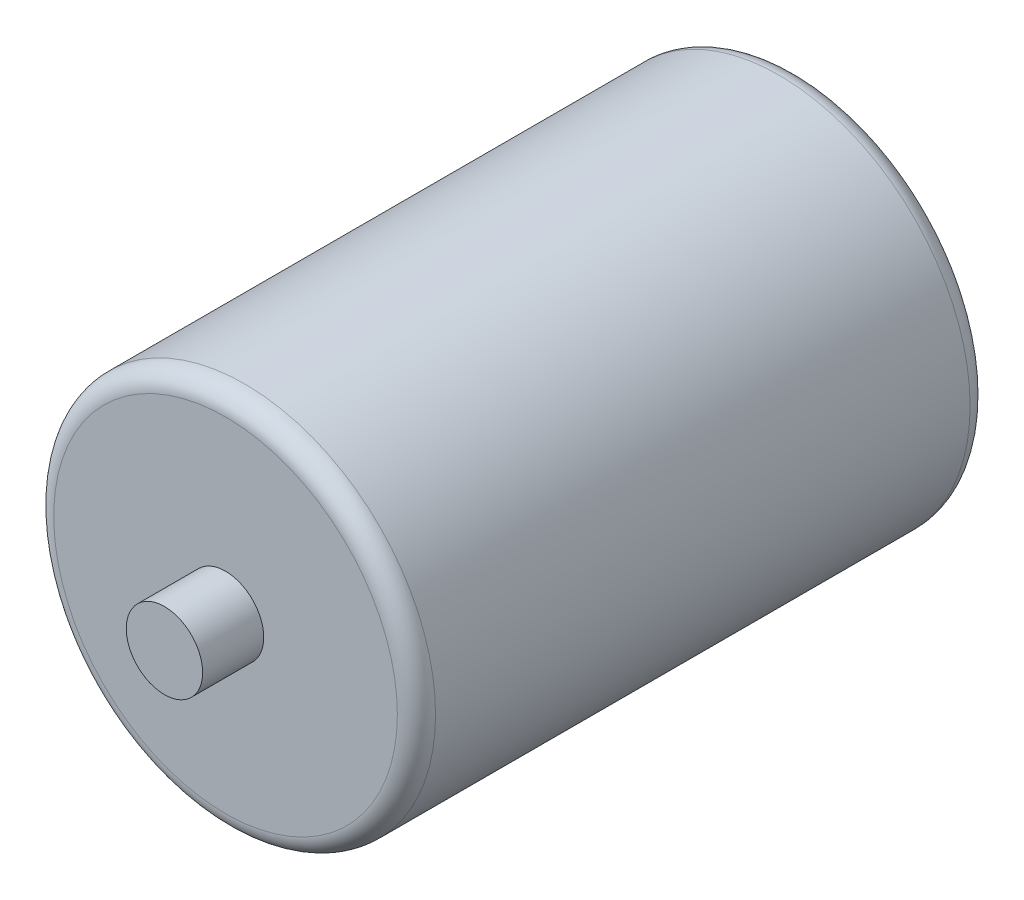
from build123d import *

# Parameters (mm, degrees)
SKETCH2_R           = 1270
BOSS_EXTRUDE1_DEPTH = 3810
SKETCH3_R           = 254
BOSS_EXTRUDE2_DEPTH = 406.4
BOSS_EXTRUDE3_START = 406.4
SKETCH4_R           = 254
BOSS_EXTRUDE3_DEPTH = 406.4
FILLET1_R           = 127


with BuildPart() as part:
    # Sketch2 → Boss-Extrude1 (new body)
    with BuildSketch(Plane.XY):
        Circle(SKETCH2_R)
    extrude(amount=BOSS_EXTRUDE1_DEPTH)

    # Sketch3 → Boss-Extrude2 (add)
    with BuildSketch(Plane.XY.offset(3810)):
        Circle(SKETCH3_R)
    extrude(amount=BOSS_EXTRUDE2_DEPTH)

    # Sketch4 → Boss-Extrude3 (add)
    with BuildSketch(Plane(origin=(0, 0, 0), x_dir=(-1, 0, 0), z_dir=(0, 0, -1)).offset(BOSS_EXTRUDE3_START)):
        with Locations(Location((0, 0, 0), (0, 0, 180))):
            Circle(SKETCH4_R)
    extrude(amount=-BOSS_EXTRUDE3_DEPTH)

    # Fillet1
    fillet1_edges = [part.edges().sort_by_distance(p)[0] for p in [
        (-1270, 0, 0),
        (-1270, 0, 3810),
    ]]
    fillet(fillet1_edges, radius=FILLET1_R)


solid = part.part
